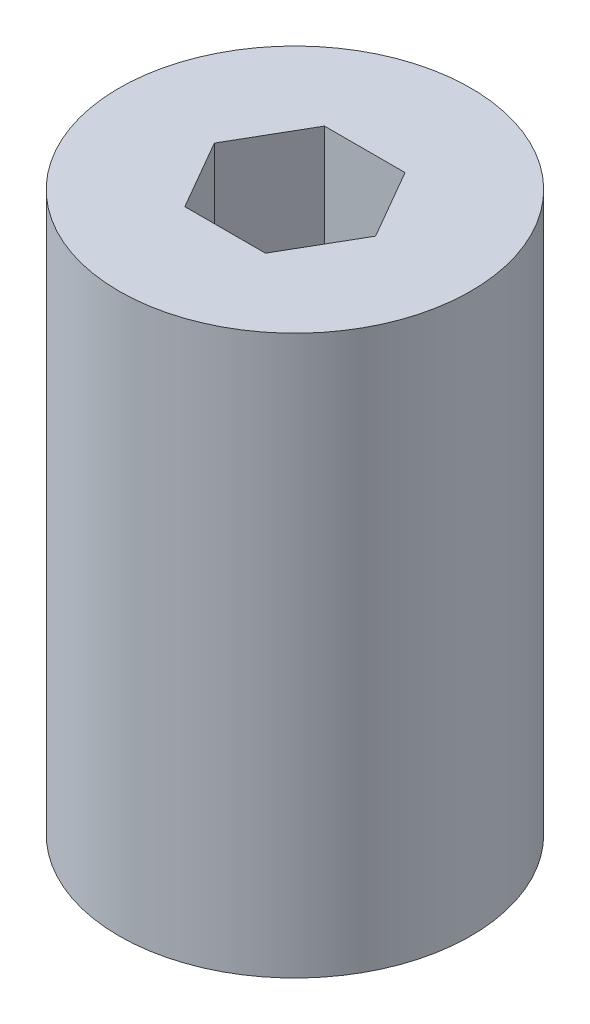
from build123d import *

# Parameters (mm, degrees)
SKETCH2_R           = 16.002
BOSS_EXTRUDE1_DEPTH = 50.8
CUT_EXTRUDE1_DEPTH  = 56.612660501


with BuildPart() as part:
    # Sketch2 → Boss-Extrude1 (new body)
    with BuildSketch(Plane(origin=(0, 0, 0), x_dir=(1, 0, 0), z_dir=(0, 1, 0))):
        with Locations(Location((0, 0, 0), (0, 0, 270))):
            Circle(SKETCH2_R)
    extrude(amount=BOSS_EXTRUDE1_DEPTH)

    # Sketch3 → Cut-Extrude1 (cut, through all)
    with BuildSketch(Plane(origin=(0, 50.8, 0), x_dir=(1, 0, 0), z_dir=(0, 1, 0))):
        Polygon((7.332348419, 0), (3.666174209, 6.35), (-3.666174209, 6.35), (-7.332348419, 0), (-3.666174209, -6.35), (3.666174209, -6.35), align=None)
    extrude(amount=-CUT_EXTRUDE1_DEPTH, mode=Mode.SUBTRACT)


solid = part.part
